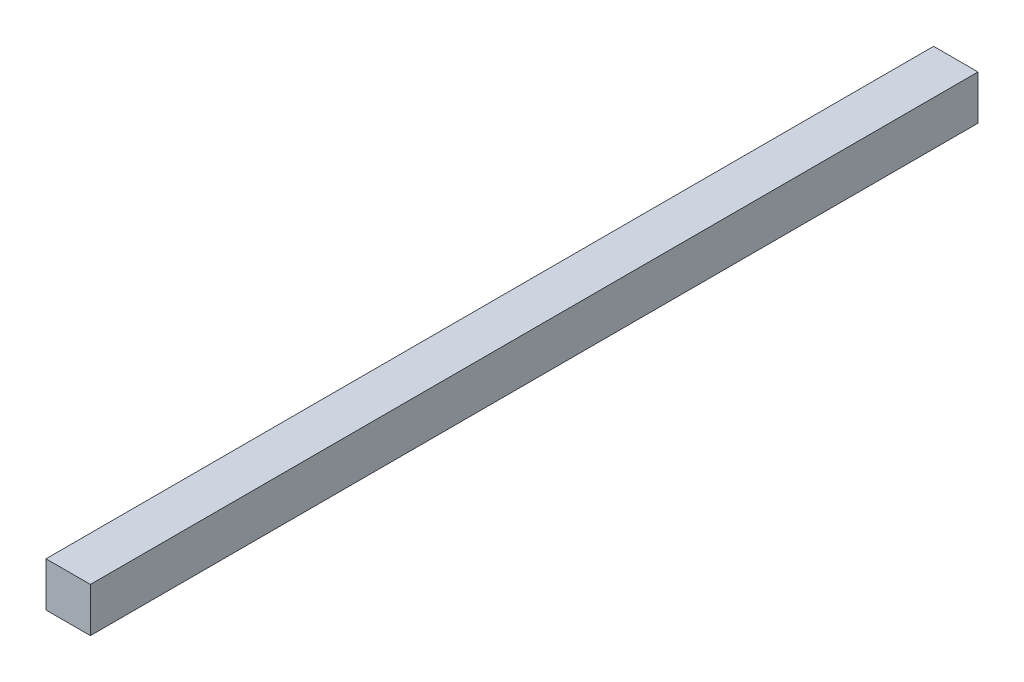
from build123d import *

# Parameters (mm, degrees)
SKETCH1_W           = 20
SKETCH1_H           = 20
BOSS_EXTRUDE1_DEPTH = 400


with BuildPart() as part:
    # Sketch1 → Boss-Extrude1 (new body)
    with BuildSketch(Plane.XY):
        Rectangle(SKETCH1_W, SKETCH1_H)
    extrude(amount=BOSS_EXTRUDE1_DEPTH)


solid = part.part
